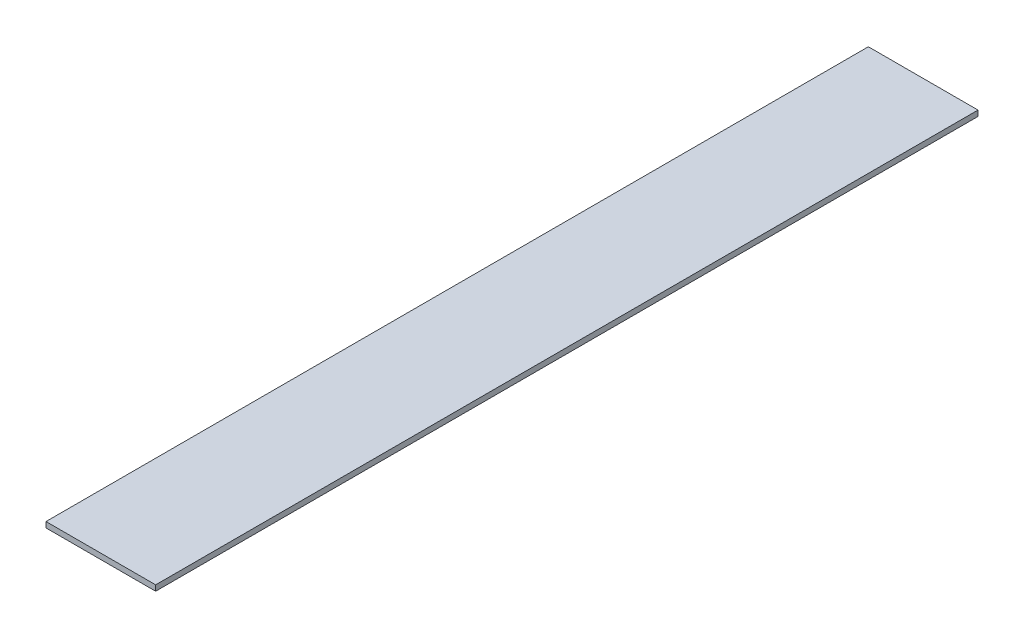
from build123d import *

# Parameters (mm, degrees)
SKETCH1_W           = 2000
SKETCH1_H           = 15000
BOSS_EXTRUDE1_DEPTH = 101.6


with BuildPart() as part:
    # Sketch1 → Boss-Extrude1 (new body)
    with BuildSketch(Plane(origin=(0, 0, 0), x_dir=(1, 0, 0), z_dir=(0, 1, 0))):
        with Locations((0, 6500)):
            Rectangle(SKETCH1_W, SKETCH1_H)
    extrude(amount=-BOSS_EXTRUDE1_DEPTH)


solid = part.part
